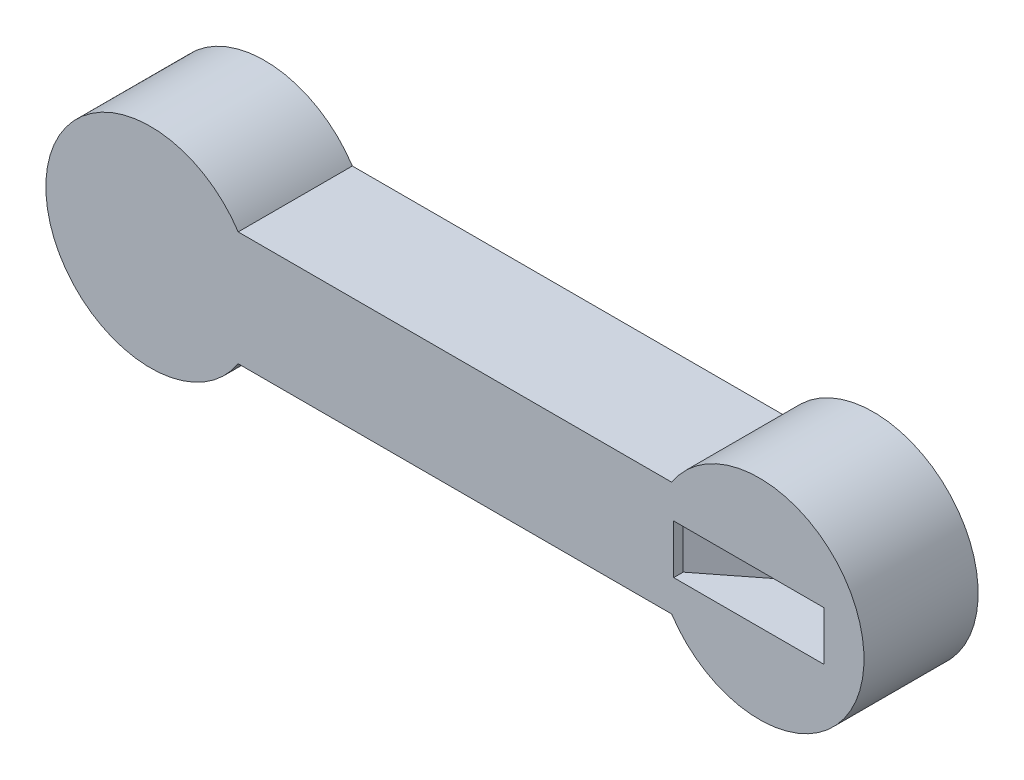
from build123d import *

# Parameters (mm, degrees)
BOSS_EXTRUDE1_DEPTH = 30
SKETCH16_W          = 33.4
SKETCH16_H          = 12.9
CUT_EXTRUDE10_DEPTH = 4.5
SKETCH17_W          = 23.45208563
SKETCH17_H          = 12.9
CUT_EXTRUDE11_DEPTH = 192.865838543
CUT_EXTRUDE13_DEPTH = 6.45
SKETCH19_R          = 20
CUT_EXTRUDE14_DEPTH = 3.65


with BuildPart() as part:
    # Sketch1 → Boss-Extrude1 (new body)
    with BuildSketch(Plane.XY):
        with BuildLine():
            ThreePointArc((187.5, 0), (167.823244805, 26.363741023), (136.951138857, 15))
            Line((136.951138857, 15), (160, 15))
            Line((160, 15), (160, -15))
            Line((160, -15), (136.951138857, -15))
            ThreePointArc((136.951138857, -15), (167.823244805, -26.363741023), (187.5, 0))
        make_face()
        with BuildLine():
            Line((160, 15), (136.951138857, 15))
            ThreePointArc((136.951138857, 15), (132.5, 0), (136.951138857, -15))
            Line((136.951138857, -15), (160, -15))
            Line((160, -15), (160, 15))
        make_face()
        with BuildLine():
            Line((136.951138857, 15), (23.048861143, 15))
            ThreePointArc((23.048861143, 15), (26.363741023, 7.823244805), (27.5, 0))
            ThreePointArc((27.5, 0), (26.363741023, -7.823244805), (23.048861143, -15))
            Line((23.048861143, -15), (136.951138857, -15))
            ThreePointArc((136.951138857, -15), (132.5, 0), (136.951138857, 15))
        make_face()
        with BuildLine():
            ThreePointArc((13.228756555, -15), (-20, 0), (13.228756555, 15))
            Line((13.228756555, 15), (23.048861143, 15))
            ThreePointArc((23.048861143, 15), (-27.5, 0), (23.048861143, -15))
            Line((23.048861143, -15), (13.228756555, -15))
        make_face()
        with BuildLine():
            Line((23.048861143, 15), (13.228756555, 15))
            ThreePointArc((13.228756555, 15), (18.228756555, 8.228756555), (20, 0))
            ThreePointArc((20, 0), (18.228756555, -8.228756555), (13.228756555, -15))
            Line((13.228756555, -15), (23.048861143, -15))
            ThreePointArc((23.048861143, -15), (26.363741023, -7.823244805), (27.5, 0))
            ThreePointArc((27.5, 0), (26.363741023, 7.823244805), (23.048861143, 15))
        make_face()
        with BuildLine():
            Line((0, -15), (0, 15))
            Line((0, 15), (13.228756555, 15))
            ThreePointArc((13.228756555, 15), (-20, 0), (13.228756555, -15))
            Line((13.228756555, -15), (0, -15))
        make_face()
        with BuildLine():
            Line((13.228756555, 15), (0, 15))
            Line((0, 15), (0, -15))
            Line((0, -15), (13.228756555, -15))
            ThreePointArc((13.228756555, -15), (18.228756555, -8.228756555), (20, 0))
            ThreePointArc((20, 0), (18.228756555, 8.228756555), (13.228756555, 15))
        make_face()
    extrude(amount=BOSS_EXTRUDE1_DEPTH)

    # Sketch16 → Cut-Extrude10 (cut)
    with BuildSketch(Plane(origin=(0, 0, 0), x_dir=(-1, 0, 0), z_dir=(0, 0, -1))):
        with Locations((-165.21934279, 0)):
            Rectangle(SKETCH16_W, SKETCH16_H)
    extrude(amount=-CUT_EXTRUDE10_DEPTH, mode=Mode.SUBTRACT)

    # Sketch17 → Cut-Extrude11 (cut, through all)
    with BuildSketch(Plane(origin=(0, 0, 0), x_dir=(-1, 0, 0), z_dir=(0, 0, -1))):
        with Locations((-165.223957185, 0)):
            Rectangle(SKETCH17_W, SKETCH17_H)
    extrude(amount=-CUT_EXTRUDE11_DEPTH, mode=Mode.SUBTRACT)

    # Sketch18 → Cut-Extrude13 (cut, symmetric)
    with BuildSketch(Plane(origin=(0, 0, 0), x_dir=(-1, 0, 0), z_dir=(0, -1, 0))):
        Polygon((-153.49791437, -15), (-153.49791437, -30), (-137.49791437, -30), (-137.49791437, -27.5), align=None)
    extrude(amount=CUT_EXTRUDE13_DEPTH, both=True, mode=Mode.SUBTRACT)

    # Sketch19 → Cut-Extrude14 (cut, symmetric)
    with BuildSketch(Plane(origin=(0, 0, 0), x_dir=(-1, 0, 0), z_dir=(0, 0, -1))):
        Circle(SKETCH19_R)
    extrude(amount=CUT_EXTRUDE14_DEPTH, both=True, mode=Mode.SUBTRACT)


solid = part.part
